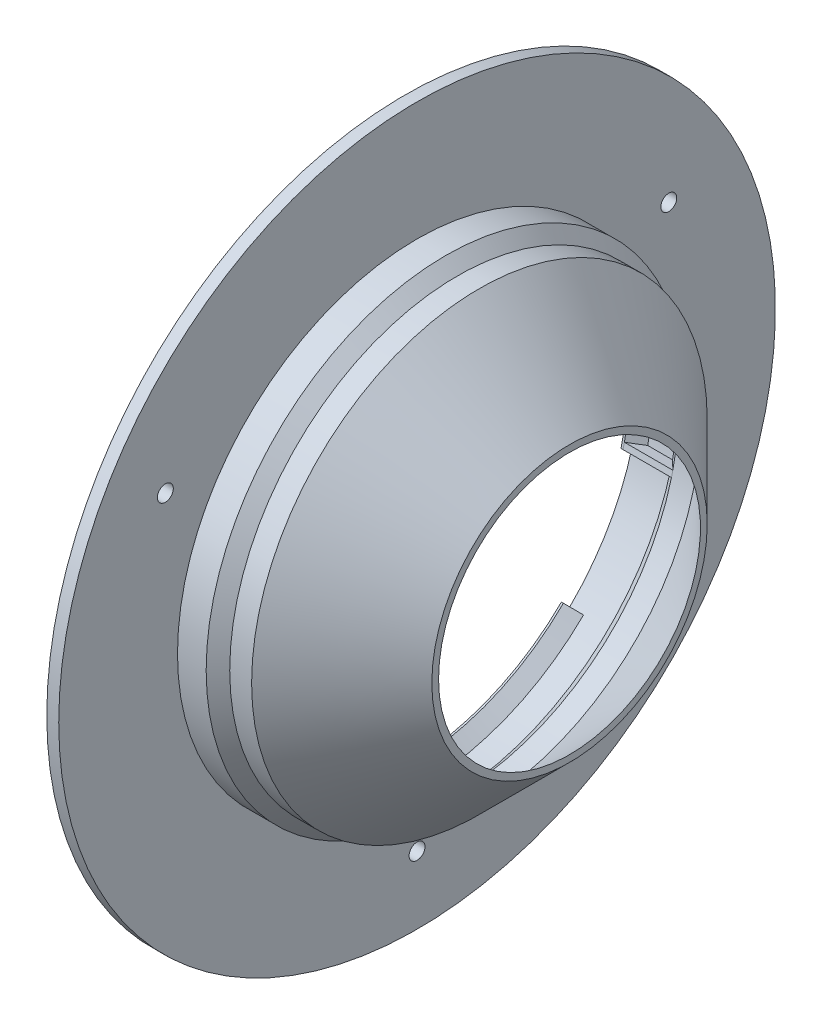
from build123d import *
from build123d.topology import SkipClean

# Parameters (mm, degrees)
CROQUIS2_R            = 2
CORTAR_EXTRUIR1_DEPTH = 5
REVOLUCI_N2_ANGLE     = 1.5
REVOLUCI_N3_ANGLE     = 1.5
MATRIZC1_COUNT        = 3


with BuildPart() as part:
    # Croquis1 → Revolución1 (revolve)
    with BuildSketch(Plane.XY):
        Polygon((0, 56), (0, 90), (3.000002354, 90), (3.000002354, 60.169848481), (10.200002354, 60.169848481), (13.157056275, 57.212794561), (18.657056275, 57.212794561), (41.284473273, 34.585377563), (41.284473273, 32.888321288), (18.16, 56.012794561), (12.66, 56.012794561), (9.70294608, 58.969848481), (3.469848481, 58.969848481), (0.5, 56), align=None)
    revolve(axis=Axis((-46.033893017, 0, 0), (1, 0, 0)))

    # Croquis2 → Cortar-Extruir1 (cut)
    with SkipClean():  # the faces are left unmerged after this step: merging them gives an invalid solid
        with BuildSketch(Plane.ZY):
            with Locations((63.219854476, 36.5)):
                Circle(CROQUIS2_R)
            with Locations((0, -73)):
                Circle(CROQUIS2_R)
            with Locations((-63.219854476, 36.5)):
                Circle(CROQUIS2_R)
            with BuildLine():
                Line((-14.422814665, 52.006989551), (-15.759006546, 56.825141817))
                ThreePointArc((-15.759006546, 56.825141817), (0, 58.969848481), (15.759006546, 56.825141817))
                Line((15.759006546, 56.825141817), (14.422814665, 52.006989551))
                ThreePointArc((14.422814665, 52.006989551), (0, 53.969848481), (-14.422814665, 52.006989551))
            make_face()
            with BuildLine():
                Line((52.250781458, -13.512970881), (57.09151966, -14.764870902))
                ThreePointArc((57.09151966, -14.764870902), (51.069386842, -29.48492424), (41.332513115, -42.060270916))
                Line((41.332513115, -42.060270916), (37.827966793, -38.49401867))
                ThreePointArc((37.827966793, -38.49401867), (46.739259823, -26.98492424), (52.250781458, -13.512970881))
            make_face()
            with BuildLine():
                Line((-37.827966793, -38.49401867), (-41.332513115, -42.060270916))
                ThreePointArc((-41.332513115, -42.060270916), (-51.069386842, -29.48492424), (-57.09151966, -14.764870902))
                Line((-57.09151966, -14.764870902), (-52.250781458, -13.512970881))
                ThreePointArc((-52.250781458, -13.512970881), (-46.739259823, -26.98492424), (-37.827966793, -38.49401867))
            make_face()
        extrude(amount=-CORTAR_EXTRUIR1_DEPTH, mode=Mode.SUBTRACT)

    # Croquis3 → Revolución2 (revolve)
    with SkipClean():  # the faces are left unmerged after this step: merging them gives an invalid solid
        with BuildSketch(Plane(origin=(0, 0, 0), x_dir=(1, 0, 0), z_dir=(0, -0.9681476403781081, 0.2503800040544404))):
            Polygon((0.5, -56), (12.66, -56.012794561), (9.70294608, -58.969848481), (3.469848481, -58.969848481), align=None)
        revoluci_n2 = revolve(axis=Axis((9.70294608, 0, 0), (1, 0, 0)), revolution_arc=REVOLUCI_N2_ANGLE)

    # Croquis5 → Revolución3 (revolve)
    with SkipClean():  # the faces are left unmerged after this step: merging them gives an invalid solid
        with BuildSketch(Plane(origin=(0, 0, 0), x_dir=(-1, 0, 0), z_dir=(0, -0.9504873560590977, -0.31076323137042167))):
            Polygon((-0.5, 56.012794561), (-3.469848481, 58.969848481), (-9.70294608, 58.969848481), (-12.66, 56.012794561), align=None)
        revoluci_n3 = revolve(axis=Axis((9.70294608, 0, 0), (1, 0, 0)), revolution_arc=REVOLUCI_N3_ANGLE)

    # MatrizC1: Revolución2, Revolución3 ×3 about axis
    matrizc1_axis = Axis((9.70294608, 0, 0), (-1, 0, 0))
    add([revoluci_n2.rotate(matrizc1_axis, i * 360 / MATRIZC1_COUNT) for i in range(1, MATRIZC1_COUNT)])
    add([revoluci_n3.rotate(matrizc1_axis, i * 360 / MATRIZC1_COUNT) for i in range(1, MATRIZC1_COUNT)])


solid = part.part
